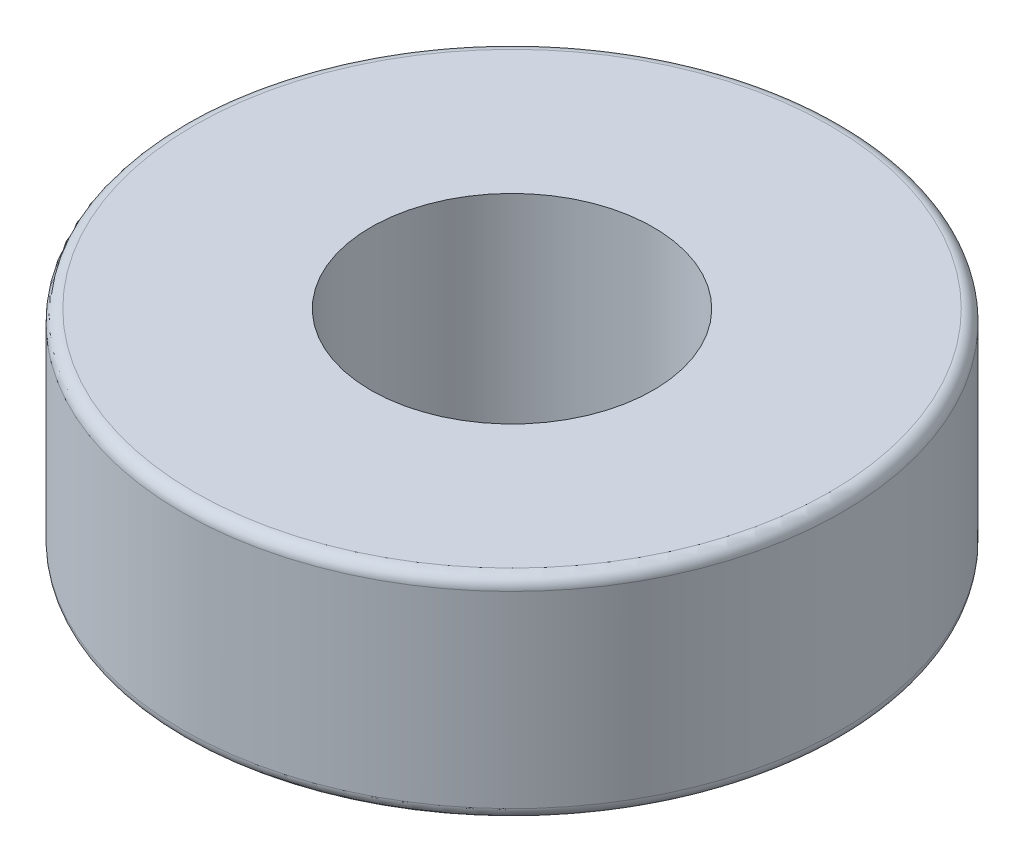
from build123d import *

# Parameters (mm, degrees)
SKETCH2_W = 6.35
SKETCH2_H = 7.142
FILLET1_R = 0.4


with BuildPart() as part:
    # Sketch2 → Revolve1 (revolve)
    with BuildSketch(Plane(origin=(0, 0, 0), x_dir=(0, 0, -1), z_dir=(1, 0, 0))):
        with Locations((-7.9375, 0)):
            Rectangle(SKETCH2_W, SKETCH2_H)
    revolve(axis=Axis((0, 0, 0), (0, -1, 0)))

    # Fillet1
    fillet1_edges = [part.edges().sort_by_distance(p)[0] for p in [
        (0, -3.571, -11.1125),
        (0, 3.571, -11.1125),
    ]]
    fillet(fillet1_edges, radius=FILLET1_R)


solid = part.part
